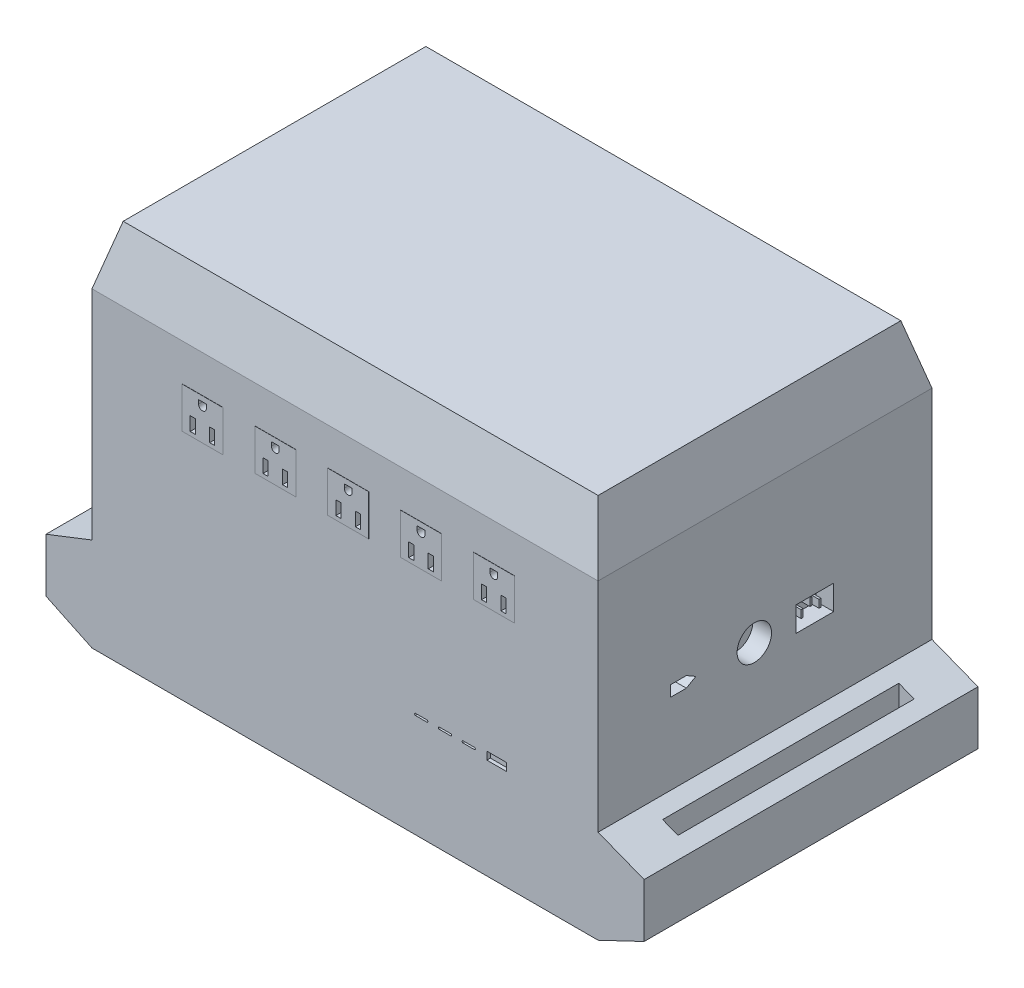
from build123d import *

# Parameters (mm, degrees)
BOSS_EXTRUDE62_DEPTH      = 0.254
BOSS_EXTRUDE63_DEPTH      = 0.254
BOSS_EXTRUDE64_DEPTH      = 0.254
BOSS_EXTRUDE65_DEPTH      = 0.254
BOSS_EXTRUDE66_DEPTH      = 14
BOSS_EXTRUDE66_DEPTH_BACK = 17.62
BOSS_EXTRUDE68_DEPTH      = 168.468
BOSS_EXTRUDE70_DEPTH      = 17.62
BOSS_EXTRUDE71_DEPTH      = 0.254
CHAMFER7_SIZE             = 10.16
CHAMFER7_SIZE2            = 38.1
BOSS_EXTRUDE72_DEPTH      = 0.254
CUT_EXTRUDE49_START       = -0.254
CUT_EXTRUDE49_DEPTH       = 0.254
BOSS_EXTRUDE73_DEPTH      = 0.254
BOSS_EXTRUDE74_DEPTH      = 0.254
BOSS_EXTRUDE75_DEPTH      = 0.254
BOSS_EXTRUDE76_DEPTH      = 0.254
BOSS_EXTRUDE77_DEPTH      = 0.254
SKETCH279_W               = 12.7
SKETCH279_H               = 5.08
CUT_EXTRUDE51_DEPTH       = 12.7
SKETCH280_W               = 10.668
SKETCH280_H               = 3.048
BOSS_EXTRUDE78_DEPTH      = 11.43
CUT_EXTRUDE52_DEPTH       = 12.7
BOSS_EXTRUDE79_DEPTH      = 11.43
CUT_EXTRUDE53_DEPTH       = 12.7
BOSS_EXTRUDE80_DEPTH      = 11.43
CUT_EXTRUDE54_DEPTH       = 12.7
BOSS_EXTRUDE81_DEPTH      = 11.43
CUT_EXTRUDE55_START       = -0.852804
SKETCH301_W               = 24.5364
SKETCH301_H               = 16.129
CUT_EXTRUDE55_DEPTH       = 11.43
SKETCH302_W               = 1.27
SKETCH302_H               = 5.08
BOSS_EXTRUDE82_DEPTH      = 8.89
SKETCH303_W               = 1.27
SKETCH303_H               = 5.08
BOSS_EXTRUDE83_DEPTH      = 8.89
SKETCH304_W               = 1.27
SKETCH304_H               = 5.08
BOSS_EXTRUDE84_DEPTH      = 8.89
CUT_EXTRUDE56_DEPTH       = 12.7
BOSS_EXTRUDE85_DEPTH      = 0.254
SKETCH321_W               = 26.67
SKETCH321_H               = 26.67
BOSS_EXTRUDE86_DEPTH      = 0.127
CUT_EXTRUDE58_DEPTH       = 5.08
SKETCH323_W               = 3.302
SKETCH323_H               = 8.89
CUT_EXTRUDE59_DEPTH       = 5.08
SKETCH332_W               = 3.302
SKETCH332_H               = 8.89
CUT_EXTRUDE60_DEPTH       = 5.08
SKETCH333_W               = 26.67
SKETCH333_H               = 26.67
BOSS_EXTRUDE87_DEPTH      = 0.127
SKETCH334_W               = 3.302
SKETCH334_H               = 8.89
CUT_EXTRUDE61_DEPTH       = 5.08
CUT_EXTRUDE62_DEPTH       = 5.08
SKETCH336_W               = 3.302
SKETCH336_H               = 8.89
CUT_EXTRUDE63_DEPTH       = 5.08
SKETCH337_W               = 26.67
SKETCH337_H               = 26.67
BOSS_EXTRUDE88_DEPTH      = 0.127
SKETCH338_W               = 3.302
SKETCH338_H               = 8.89
CUT_EXTRUDE64_DEPTH       = 5.08
SKETCH339_W               = 3.302
SKETCH339_H               = 8.89
CUT_EXTRUDE65_DEPTH       = 5.08
CUT_EXTRUDE66_DEPTH       = 5.08
SKETCH341_W               = 26.67
SKETCH341_H               = 26.67
BOSS_EXTRUDE89_DEPTH      = 0.127
SKETCH342_W               = 3.302
SKETCH342_H               = 8.89
CUT_EXTRUDE67_DEPTH       = 5.08
CUT_EXTRUDE68_DEPTH       = 5.08
SKETCH344_W               = 3.302
SKETCH344_H               = 8.89
CUT_EXTRUDE69_DEPTH       = 5.08
SKETCH345_W               = 26.67
SKETCH345_H               = 26.67
BOSS_EXTRUDE90_DEPTH      = 0.127
CUT_EXTRUDE70_DEPTH       = 5.08
SKETCH347_W               = 3.302
SKETCH347_H               = 8.89
CUT_EXTRUDE71_DEPTH       = 5.08
SKETCH357_W               = 3.302
SKETCH357_H               = 8.89
CUT_EXTRUDE72_DEPTH       = 5.08
SKETCH358_W               = 11.2395
SKETCH358_H               = 12.192
CUT_EXTRUDE74_DEPTH       = 154
SKETCH360_W               = 10
SKETCH360_H               = 154
CUT_EXTRUDE75_DEPTH       = 333.221604562


with BuildPart() as part:
    # Sketch222 → Boss-Extrude62 (new body)
    with BuildSketch(Plane(origin=(153.035, 0, 0), x_dir=(0, 0, -1), z_dir=(1, 0, 0))):
        Polygon((0.034354968, -137.616206731), (-0.42013952, -134.167377053), (-0.762282621, -134.212281886), (-0.539863782, -135.902665064), (-1.925280449, -136.084956731), (-1.880408654, -136.425000801), (-0.494991987, -136.242709135), (-0.352664263, -137.321034455), (-1.738080929, -137.503326122), (-1.693209135, -137.843370192), align=None)
    extrude(amount=-BOSS_EXTRUDE62_DEPTH)


with BuildPart() as body_2:
    # Sketch227 → Boss-Extrude63 (new body)
    with BuildSketch(Plane(origin=(153.035, 0, 0), x_dir=(0, 0, -1), z_dir=(1, 0, 0))):
        with BuildLine():
            Line((-2.696108223, -138.305593274), (-4.132005659, -136.787664588))
            add(Edge.make_bspline(
                [(-4.678880659, -136.300384941), (-4.662372458, -136.310203099), (-4.626569225, -136.331496866), (-4.572153803, -136.371143308), (-4.512969105, -136.420202524), (-4.446642385, -136.475791675), (-4.376015257, -136.541791218), (-4.299096257, -136.615629275), (-4.217101907, -136.698669745), (-4.161134246, -136.757201507), (-4.132005659, -136.787664588)],
                knots=[0, 0, 0, 0, 0.078414816, 0.170067223, 0.274567044, 0.392385654, 0.523434769, 0.669246216, 0.827857912, 1, 1, 1, 1], degree=3))
            add(Edge.make_bspline(
                [(-4.678880659, -136.300384941), (-5.349031432, -135.906931528), (-5.991380659, -136.538766351)],
                knots=[3.246843398, 3.246843398, 3.246843398, 4.549300373, 4.549300373, 4.549300373], degree=2, weights=[1, 0.795339734, 1]))
            add(Edge.make_bspline(
                [(-5.991380659, -136.538766351), (-6.789321702, -137.384120504), (-5.7964688, -138.361683018)],
                knots=[2.954878484, 2.954878484, 2.954878484, 3.420148464, 3.420148464, 3.420148464], degree=2, weights=[1, 0.973062297, 1]))
            Line((-5.7964688, -138.361683018), (-4.360571364, -139.879611704))
            Line((-4.360571364, -139.879611704), (-4.10886864, -139.641230293))
            Line((-4.10886864, -139.641230293), (-5.544766076, -138.123301608))
            add(Edge.make_bspline(
                [(-5.891821364, -137.70613414), (-5.885456743, -137.71723327), (-5.87141033, -137.741728514), (-5.843814067, -137.779512212), (-5.810644297, -137.823423398), (-5.769994836, -137.872441024), (-5.724261781, -137.928237126), (-5.669768185, -137.987941593), (-5.609630917, -138.053988586), (-5.567025567, -138.099515647), (-5.544766076, -138.123301608)],
                knots=[0, 0, 0, 0, 0.070556672, 0.155715166, 0.257861403, 0.374283895, 0.507046631, 0.655920453, 0.820233007, 1, 1, 1, 1], degree=3))
            add(Edge.make_bspline(
                [(-5.752298127, -136.765228691), (-6.180560511, -137.186653364), (-5.891821364, -137.70613414)],
                knots=[5.71786085, 5.71786085, 5.71786085, 6.800901202, 6.800901202, 6.800901202], degree=2, weights=[1, 0.856926113, 1]))
            add(Edge.make_bspline(
                [(-4.711132262, -136.697920999), (-5.164221722, -136.271568089), (-5.752298127, -136.765228691)],
                knots=[5.997963475, 5.997963475, 5.997963475, 7.159261747, 7.159261747, 7.159261747], degree=2, weights=[1, 0.836106732, 1]))
            ThreePointArc((-4.711132262, -136.697920999), (-4.543178842, -136.857374758), (-4.383007262, -137.024643755))
            Line((-4.383007262, -137.024643755), (-2.947109826, -138.542572441))
            Line((-2.947109826, -138.542572441), (-2.696108223, -138.305593274))
        make_face()
    extrude(amount=-BOSS_EXTRUDE63_DEPTH)


with BuildPart() as body_3:
    # Sketch232 → Boss-Extrude64 (new body)
    with BuildSketch(Plane(origin=(153.035, 0, 0), x_dir=(0, 0, -1), z_dir=(1, 0, 0))):
        with BuildLine():
            Line((-5.999563362, -142.300803327), (-5.847419933, -142.624721596))
            add(Edge.make_bspline(
                [(-5.099322978, -141.845775282), (-5.109063734, -141.885114505), (-5.128433416, -141.96334131), (-5.17532759, -142.074858394), (-5.237222399, -142.178634171), (-5.299641397, -142.259376778), (-5.358663783, -142.319859589), (-5.409161525, -142.365696541), (-5.466807739, -142.409999971), (-5.530151525, -142.454681007), (-5.600571903, -142.497700369), (-5.67686431, -142.54127167), (-5.759681766, -142.584055093), (-5.817634874, -142.610916268), (-5.847419933, -142.624721596)],
                knots=[0, 0, 0, 0, 0.107800502, 0.214363382, 0.320667901, 0.428850354, 0.48518453, 0.545550989, 0.610285758, 0.678654818, 0.751879039, 0.829919405, 0.912586904, 1, 1, 1, 1], degree=3))
            add(Edge.make_bspline(
                [(-5.099322978, -141.845775282), (-4.94215136, -141.017999915), (-5.726125862, -140.848078968)],
                knots=[5.510255877, 5.510255877, 5.510255877, 6.837982393, 6.837982393, 6.837982393], degree=2, weights=[1, 0.787617714, 1]))
            add(Edge.make_bspline(
                [(-6.286322176, -140.918892269), (-6.26308623, -140.908741937), (-6.217222754, -140.888707054), (-6.147157979, -140.864892942), (-6.077030091, -140.847242498), (-6.006973957, -140.83508481), (-5.93656202, -140.829636782), (-5.866260297, -140.829713704), (-5.795789759, -140.834852164), (-5.749432576, -140.843653816), (-5.726125862, -140.848078968)],
                knots=[0, 0, 0, 0, 0.132319091, 0.26117349, 0.385740735, 0.509486853, 0.631872451, 0.753868284, 0.876253882, 1, 1, 1, 1], degree=3))
            add(Edge.make_bspline(
                [(-6.865448779, -141.352185538), (-6.83236233, -141.323555956), (-6.769157487, -141.26886504), (-6.677368396, -141.192625437), (-6.59359611, -141.124909349), (-6.517839596, -141.065837551), (-6.448486313, -141.016881848), (-6.388295664, -140.975311369), (-6.335295177, -140.942890428), (-6.301627049, -140.926392091), (-6.286322176, -140.918892269)],
                knots=[0, 0, 0, 0, 0.181046757, 0.345852518, 0.493713477, 0.626794068, 0.743261104, 0.844918802, 0.929503119, 1, 1, 1, 1], degree=3))
            add(Edge.make_bspline(
                [(-7.536422337, -141.822638263), (-7.30242829, -141.742786071), (-6.865448779, -141.352185538)],
                knots=[0.382022896, 0.382022896, 0.382022896, 1.923493301, 1.923493301, 1.923493301], degree=2, weights=[1, 0.717398675, 1]))
            add(Edge.make_bspline(
                [(-7.898201183, -141.867510057), (-7.869294792, -141.871974114), (-7.810742906, -141.881016368), (-7.720087306, -141.876815441), (-7.627541099, -141.857408107), (-7.567467841, -141.834484861), (-7.536422337, -141.822638263)],
                knots=[0, 0, 0, 0, 0.236659437, 0.479369993, 0.730941497, 1, 1, 1, 1], degree=3))
            add(Edge.make_bspline(
                [(-8.345516888, -141.113804128), (-8.463214925, -141.742146487), (-7.898201183, -141.867510057)],
                knots=[2.17472102, 2.17472102, 2.17472102, 3.554152535, 3.554152535, 3.554152535], degree=2, weights=[1, 0.771426915, 1]))
            add(Edge.make_bspline(
                [(-7.631774901, -140.524160698), (-7.681609506, -140.540182257), (-7.777008312, -140.570852462), (-7.909591401, -140.6276724), (-8.025260253, -140.691125996), (-8.124163748, -140.761442404), (-8.206201786, -140.83900069), (-8.270661542, -140.924036059), (-8.319747787, -141.015419372), (-8.3369492, -141.081093251), (-8.345516888, -141.113804128)],
                knots=[0, 0, 0, 0, 0.161452539, 0.309069959, 0.444318968, 0.567798245, 0.682555306, 0.791156797, 0.895979279, 1, 1, 1, 1], degree=3))
            Line((-7.631774901, -140.524160698), (-7.74465551, -140.19673682))
            add(Edge.make_bspline(
                [(-8.684859837, -141.075943551), (-8.678937999, -141.050363531), (-8.667195929, -140.999642381), (-8.642979468, -140.92624078), (-8.615014355, -140.855230573), (-8.581284231, -140.787706924), (-8.543310135, -140.722677215), (-8.500367466, -140.660832295), (-8.452534012, -140.601804837), (-8.399709539, -140.545438706), (-8.341171411, -140.491628284), (-8.275691262, -140.441407563), (-8.2038933, -140.393425728), (-8.124882967, -140.348821136), (-8.039710443, -140.305900331), (-7.947132059, -140.266981037), (-7.848573799, -140.229575973), (-7.779827534, -140.207851509), (-7.74465551, -140.19673682)],
                knots=[0, 0, 0, 0, 0.057910088, 0.114826584, 0.170369117, 0.226181524, 0.281194839, 0.336413226, 0.392146955, 0.448697817, 0.506734058, 0.567387419, 0.630606369, 0.697129601, 0.767471085, 0.840941519, 0.918622362, 1, 1, 1, 1], degree=3))
            add(Edge.make_bspline(
                [(-8.684859837, -141.075943551), (-8.952427243, -142.080572794), (-7.969014484, -142.238403487)],
                knots=[0.733034147, 0.733034147, 0.733034147, 2.609824335, 2.609824335, 2.609824335], degree=2, weights=[1, 0.59108332, 1]))
            add(Edge.make_bspline(
                [(-6.709098619, -141.695735218), (-6.743285695, -141.725844714), (-6.809496613, -141.784158485), (-6.90848203, -141.865730251), (-7.003688476, -141.938665721), (-7.095027598, -142.003255694), (-7.181741495, -142.060326682), (-7.264496705, -142.108953279), (-7.343386179, -142.149245992), (-7.418766096, -142.181954001), (-7.491882372, -142.207099629), (-7.562860973, -142.228010875), (-7.633033584, -142.242407276), (-7.702286891, -142.252742001), (-7.770547915, -142.256684382), (-7.837765824, -142.255978803), (-7.903992062, -142.250838157), (-7.947338315, -142.242548765), (-7.969014484, -142.238403487)],
                knots=[0, 0, 0, 0, 0.095915869, 0.185762528, 0.270010877, 0.348380461, 0.421263637, 0.48852803, 0.550368245, 0.607680642, 0.661371874, 0.713080446, 0.763362119, 0.812075886, 0.860390352, 0.90714086, 0.953563911, 1, 1, 1, 1], degree=3))
            ThreePointArc((-6.709098619, -141.695735218), (-6.495160019, -141.507397081), (-6.275104228, -141.326244032))
            add(Edge.make_bspline(
                [(-5.786422337, -141.203547718), (-5.8050704, -141.200367125), (-5.842183249, -141.1940372), (-5.89887102, -141.191238244), (-5.955689092, -141.19502588), (-6.013864713, -141.204072046), (-6.074238613, -141.221179728), (-6.137588381, -141.248193916), (-6.206052434, -141.282218135), (-6.251293834, -141.311063051), (-6.275104228, -141.326244032)],
                knots=[0, 0, 0, 0, 0.109431286, 0.217787054, 0.327568948, 0.43854452, 0.55802446, 0.689659623, 0.836668921, 1, 1, 1, 1], degree=3))
            add(Edge.make_bspline(
                [(-5.450584997, -141.764445154), (-5.325881416, -141.285360442), (-5.786422337, -141.203547718)],
                knots=[4.307060765, 4.307060765, 4.307060765, 6.002801772, 6.002801772, 6.002801772], degree=2, weights=[1, 0.661581497, 1]))
            add(Edge.make_bspline(
                [(-5.999563362, -142.300803327), (-5.975894909, -142.28948002), (-5.930160809, -142.267600209), (-5.864986392, -142.233841816), (-5.805041785, -142.201172647), (-5.751598109, -142.168116306), (-5.703173677, -142.137040657), (-5.662148009, -142.104786282), (-5.624983386, -142.075390695), (-5.58536285, -142.034920166), (-5.542382614, -141.983270065), (-5.501659019, -141.915315724), (-5.469996112, -141.842217385), (-5.457116636, -141.790614703), (-5.450584997, -141.764445154)],
                knots=[0, 0, 0, 0, 0.098351719, 0.190043153, 0.27513935, 0.354174642, 0.425614467, 0.49062449, 0.549741308, 0.603019033, 0.702634755, 0.800900588, 0.899029628, 1, 1, 1, 1], degree=3))
        make_face()
    extrude(amount=-BOSS_EXTRUDE64_DEPTH)


with BuildPart() as body_4:
    # Sketch237 → Boss-Extrude65 (new body)
    with BuildSketch(Plane(origin=(153.035, 0, 0), x_dir=(0, 0, -1), z_dir=(1, 0, 0))):
        Polygon((-5.273509799, -144.160084418), (-8.49656669, -145.436126085), (-7.77020451, -147.269559579), (-7.452596337, -147.144058777), (-8.05135435, -145.632440188), (-6.787231754, -145.131839226), (-6.188473741, -146.643457816), (-5.872968933, -146.517957014), (-6.471726946, -145.006338425), (-5.463513805, -144.607400123), (-4.85984794, -146.132340027), (-4.542239767, -146.006839226), align=None)
    extrude(amount=-BOSS_EXTRUDE65_DEPTH)


with BuildPart() as body_5:
    # Sketch242 → Boss-Extrude66 (new, two sides: drawn at the far end of the back side and taken through both)
    with BuildSketch(Plane(origin=(0, 0, -101.854), x_dir=(-1, 0, 0), z_dir=(0, 0, -1)).offset(-BOSS_EXTRUDE66_DEPTH_BACK)):
        Polygon((167.149803952, -19.122662796), (-162.850196048, -19.122662796), (-162.850196048, -199.122662796), (-192.850196048, -210.839421848), (-192.850196048, -245.839421848), (-162.850196048, -260.122662796), (167.149803952, -260.122662796), (197.149803952, -245.839421848), (197.149803952, -210.839421848), (167.149803952, -199.122662796), align=None)
    extrude(amount=BOSS_EXTRUDE66_DEPTH + BOSS_EXTRUDE66_DEPTH_BACK)

    # Sketch244 → Boss-Extrude68 (add)
    with BuildSketch(Plane.XY.offset(-84.234)):
        Polygon((-167.149803952, -260.122662796), (-197.149803952, -245.839421848), (-197.149803952, -210.839421848), (-167.149803952, -199.122662796), (-167.149803952, -19.122662796), (162.850196048, -19.122662796), (162.850196048, -199.122662796), (192.850196048, -210.839421848), (192.850196048, -245.839421848), (162.850196048, -260.122662796), align=None)
    extrude(amount=BOSS_EXTRUDE68_DEPTH)

    # Sketch246 → Boss-Extrude70 (add)
    with BuildSketch(Plane.XY.offset(84.234)):
        Polygon((162.850196048, -199.122662796), (192.850196048, -210.839421848), (192.850196048, -245.839421848), (162.850196048, -260.122662796), (-167.149803952, -260.122662796), (-197.149803952, -245.839421848), (-197.149803952, -210.839421848), (-167.149803952, -199.122662796), (-167.149803952, -19.122662796), (162.850196048, -19.122662796), align=None)
    extrude(amount=BOSS_EXTRUDE70_DEPTH)

    # Sketch252 → Boss-Extrude71 (add)
    with BuildSketch(Plane.ZY.offset(163.703)):
        with BuildLine():
            Line((-11.778846154, -143.2), (-12.479266827, -143.2))
            ThreePointArc((-12.479266827, -143.2), (-12.876761888, -143.192971947), (-13.272235577, -143.152323718))
            add(Edge.make_bspline(
                [(-13.977564103, -142.264002404), (-13.997889265, -142.991240506), (-13.272235577, -143.152323718)],
                knots=[2.612710294, 2.612710294, 2.612710294, 3.903655022, 3.903655022, 3.903655022], degree=2, weights=[1, 0.798815693, 1]))
            Line((-13.977564103, -142.264002404), (-14.022435897, -143.688549892))
            Line((-14.022435897, -143.688549892), (-14.022435897, -139.7))
            Line((-14.022435897, -139.7), (-13.634014423, -139.7))
            Line((-13.634014423, -139.7), (-13.634014423, -141.315384615))
            Line((-13.634014423, -141.315384615), (-12.092948718, -141.315384615))
            Line((-12.092948718, -141.315384615), (-12.092948718, -139.7))
            Line((-12.092948718, -139.7), (-11.778846154, -139.7))
            Line((-11.778846154, -139.7), (-11.778846154, -143.2))
        make_face()
    extrude(amount=BOSS_EXTRUDE71_DEPTH)

    # Chamfer7
    chamfer7_edges = [body_5.edges().sort_by_distance(p)[0] for p in [
        (162.850196048, -19.122662796, -7),
        (-167.149803952, -19.122662796, -7),
        (-2.149803952, -19.122662796, 101.854),
        (-2.149803952, -19.122662796, -115.854),
    ]]
    chamfer7_side = [body_5.faces().sort_by_distance(p)[0] for p in [
        (-2.149803952, -19.122662796, -7),
    ]]
    chamfer(chamfer7_edges, length=CHAMFER7_SIZE, length2=CHAMFER7_SIZE2, reference=chamfer7_side[0])

    # Sketch253 → Boss-Extrude72 (add)
    with BuildSketch(Plane.ZY.offset(167.149803952)):
        with BuildLine():
            add(Edge.make_bspline(
                [(-1.929487179, -143.28974359), (-0.124286675, -143.279325183), (-0.112179487, -141.434575321)],
                knots=[2.54181032, 2.54181032, 2.54181032, 4.026500397, 4.026500397, 4.026500397], degree=2, weights=[1, 0.736885299, 1]))
            add(Edge.make_bspline(
                [(-0.112179487, -141.434575321), (-0.007788697, -139.493930813), (-1.957532051, -139.61025641)],
                knots=[0.623390148, 0.623390148, 0.623390148, 2.491593261, 2.491593261, 2.491593261], degree=2, weights=[1, 0.594541073, 1]))
            add(Edge.make_bspline(
                [(-1.957532051, -139.61025641), (-3.893543925, -139.507231889), (-3.791666667, -141.451402244)],
                knots=[0.635551913, 0.635551913, 0.635551913, 2.482047765, 2.482047765, 2.482047765], degree=2, weights=[1, 0.603232911, 1]))
            add(Edge.make_bspline(
                [(-3.791666667, -141.451402244), (-3.870755775, -143.37554185), (-1.929487179, -143.28974359)],
                knots=[3.789872842, 3.789872842, 3.789872842, 5.545633515, 5.545633515, 5.545633515], degree=2, weights=[1, 0.638783419, 1]))
        make_face()
    extrude(amount=BOSS_EXTRUDE72_DEPTH)

    # Sketch254 → Cut-Extrude49 (cut)
    with BuildSketch(Plane.ZY.offset(167.403803952).offset(CUT_EXTRUDE49_START)):
        with BuildLine():
            add(Edge.make_bspline(
                [(-1.944911859, -139.969230769), (-3.473521434, -139.994036287), (-3.477564103, -141.452103365)],
                knots=[5.449528241, 5.449528241, 5.449528241, 6.837835776, 6.837835776, 6.837835776], degree=2, weights=[1, 0.768595341, 1]))
            add(Edge.make_bspline(
                [(-3.477564103, -141.452103365), (-3.499988268, -142.9026144), (-1.944911859, -142.930769231)],
                knots=[5.967408591, 5.967408591, 5.967408591, 7.478038568, 7.478038568, 7.478038568], degree=2, weights=[1, 0.728055649, 1]))
            add(Edge.make_bspline(
                [(-1.944911859, -142.930769231), (-0.41354277, -142.901601423), (-0.426282051, -141.435977564)],
                knots=[5.242310528, 5.242310528, 5.242310528, 6.736784146, 6.736784146, 6.736784146], degree=2, weights=[1, 0.733569571, 1]))
            add(Edge.make_bspline(
                [(-0.426282051, -141.435977564), (-0.329189577, -139.89041296), (-1.944911859, -139.969230769)],
                knots=[3.665395708, 3.665395708, 3.665395708, 5.531042126, 5.531042126, 5.531042126], degree=2, weights=[1, 0.595568462, 1]))
        make_face()
    extrude(amount=-CUT_EXTRUDE49_DEPTH, mode=Mode.SUBTRACT)

    # Sketch256 → Boss-Extrude73 (add)
    with BuildSketch(Plane.ZY.offset(167.149803952)):
        with BuildLine():
            Line((11.240384615, -142.123076923), (11.554487179, -142.123076923))
            add(Edge.make_bspline(
                [(10.413060897, -143.28974359), (11.572883316, -143.336041335), (11.554487179, -142.123076923)],
                knots=[3.559984364, 3.559984364, 3.559984364, 5.247750415, 5.247750415, 5.247750415], degree=2, weights=[1, 0.664566333, 1]))
            add(Edge.make_bspline(
                [(9.355769231, -142.249278846), (9.332286609, -143.357231486), (10.413060897, -143.28974359)],
                knots=[0.828508128, 0.828508128, 0.828508128, 2.570188795, 2.570188795, 2.570188795], degree=2, weights=[1, 0.644184028, 1]))
            add(Edge.make_bspline(
                [(9.355769231, -142.249278846), (9.357465391, -142.200532151), (9.360827947, -142.103894195), (9.389499853, -141.961862635), (9.434476408, -141.824429306), (9.487979842, -141.713391462), (9.541750568, -141.62382282), (9.59147646, -141.550765068), (9.648906646, -141.471671664), (9.714886908, -141.386627694), (9.790413872, -141.296718808), (9.872606431, -141.199529487), (9.965091208, -141.098131532), (10.029714797, -141.028796346), (10.063201122, -140.99286859)],
                knots=[0, 0, 0, 0, 0.098684951, 0.195638122, 0.292371336, 0.391068783, 0.444585255, 0.503947734, 0.570059743, 0.642613903, 0.721976686, 0.807954682, 0.900486928, 1, 1, 1, 1], degree=3))
            Line((10.063201122, -140.99286859), (10.938902244, -140.058974359))
            Line((10.938902244, -140.058974359), (9.310897436, -140.058974359))
            Line((9.310897436, -140.058974359), (9.310897436, -139.7))
            Line((9.310897436, -139.7), (11.689102564, -139.7))
            Line((11.689102564, -139.7), (11.689102564, -139.73175051))
            add(Edge.make_bspline(
                [(11.689102564, -139.73175051), (11.236645299, -140.204006216), (10.751137808, -140.710758347), (10.235197821, -141.249274626), (10.145446028, -141.346042341), (10.064704818, -141.435709677), (9.992920634, -141.518673971), (9.93003441, -141.594464892), (9.876247354, -141.663676397), (9.831321739, -141.725714532), (9.783709949, -141.798594339), (9.738308947, -141.887681869), (9.698406112, -141.996003864), (9.674249479, -142.107759457), (9.671336865, -142.183257707), (9.669871795, -142.221233974)],
                knots=[-1.516771106, -1.516771106, -1.516771106, -1.516771106, 0, 0.110794173, 0.212812933, 0.30607791, 0.390617458, 0.467232727, 0.534450618, 0.593866801, 0.644832969, 0.736220619, 0.825037402, 0.911992313, 1, 1, 1, 1], degree=3))
            add(Edge.make_bspline(
                [(9.669871795, -142.221233974), (9.630186637, -142.976356496), (10.429186699, -142.930769231)],
                knots=[0.495399928, 0.495399928, 0.495399928, 2.372577772, 2.372577772, 2.372577772], degree=2, weights=[1, 0.590926965, 1]))
            add(Edge.make_bspline(
                [(10.429186699, -142.930769231), (11.194747675, -142.94016904), (11.240384615, -142.123076923)],
                knots=[2.629699464, 2.629699464, 2.629699464, 3.910289785, 3.910289785, 3.910289785], degree=2, weights=[1, 0.801919454, 1]))
        make_face()
    extrude(amount=BOSS_EXTRUDE73_DEPTH)

    # Sketch257 → Boss-Extrude74 (add)
    with BuildSketch(Plane.ZY.offset(167.149803952)):
        Polygon((-4.28525641, -143.2), (-4.609174679, -143.2), (-5.294871795, -140.631089744), (-6.335797571, -143.257778478), (-7.358974359, -140.650721154), (-8.047475962, -143.2), (-8.368589744, -143.2), (-8.368589744, -139.7), (-7.380008013, -139.7), (-6.326923077, -142.375480769), (-5.262620192, -139.7), (-4.28525641, -139.7), align=None)
    extrude(amount=BOSS_EXTRUDE74_DEPTH)

    # Sketch258 → Boss-Extrude75 (add)
    with BuildSketch(Plane.ZY.offset(167.149803952)):
        Polygon((-9.176282051, -143.2), (-11.150641026, -143.2), (-11.150641026, -142.841025641), (-9.490384615, -142.841025641), (-9.490384615, -141.764102564), (-11.150641026, -141.764102564), (-11.150641026, -141.405128205), (-9.490384615, -141.405128205), (-9.490384615, -140.058974359), (-11.150641026, -140.058974359), (-11.150641026, -139.7), (-9.176282051, -139.7), align=None)
    extrude(amount=BOSS_EXTRUDE75_DEPTH)

    # Sketch265 → Boss-Extrude76 (add)
    with BuildSketch(Plane.ZY.offset(163.703)):
        Polygon((13.637520032, -143.2), (12.990384615, -143.2), (12.990384615, -139.7), (13.304487179, -139.7), (13.304487179, -142.841025641), (13.637520032, -142.841025641), align=None)
    extrude(amount=BOSS_EXTRUDE76_DEPTH)

    # Sketch272 → Boss-Extrude77 (add)
    with BuildSketch(Plane.ZY.offset(163.703)):
        Polygon((7.605769231, -143.2), (7.269230769, -143.2), (6.103265224, -140.443890224), (4.936598558, -143.2), (4.599358974, -143.2), (4.599358974, -136.093939394), align=None)
    extrude(amount=BOSS_EXTRUDE77_DEPTH)

    # Sketch279 → Cut-Extrude51 (cut)
    with BuildSketch(Plane.XY.offset(101.854)):
        with Locations((96.647, -192.151)):
            Rectangle(SKETCH279_W, SKETCH279_H)
    extrude(amount=-CUT_EXTRUDE51_DEPTH, mode=Mode.SUBTRACT)

    # Sketch280 → Boss-Extrude78 (add)
    with BuildSketch(Plane.XY.offset(89.154)):
        with Locations((96.647, -192.151)):
            Rectangle(SKETCH280_W, SKETCH280_H)
    extrude(amount=BOSS_EXTRUDE78_DEPTH)

    # Sketch281 → Cut-Extrude52 (cut)
    with BuildSketch(Plane.XY.offset(101.854)):
        with BuildLine():
            Line((82.169, -191.516), (74.803, -191.516))
            ThreePointArc((74.803, -191.516), (74.168, -192.151), (74.803, -192.786))
            Line((74.803, -192.786), (82.169, -192.786))
            ThreePointArc((82.169, -192.786), (82.804, -192.151), (82.169, -191.516))
        make_face()
    extrude(amount=-CUT_EXTRUDE52_DEPTH, mode=Mode.SUBTRACT)

    # Sketch282 → Boss-Extrude79 (add)
    with BuildSketch(Plane.XY.offset(89.154)):
        with BuildLine():
            Line((74.803, -192.024), (82.169, -192.024))
            ThreePointArc((82.169, -192.024), (82.296, -192.151), (82.169, -192.278))
            Line((82.169, -192.278), (74.803, -192.278))
            ThreePointArc((74.803, -192.278), (74.676, -192.151), (74.803, -192.024))
        make_face()
    extrude(amount=BOSS_EXTRUDE79_DEPTH)

    # Sketch290 → Cut-Extrude53 (cut)
    with BuildSketch(Plane.XY.offset(101.854)):
        with BuildLine():
            Line((59.309, -192.786), (66.675, -192.786))
            ThreePointArc((66.675, -192.786), (67.31, -192.151), (66.675, -191.516))
            Line((66.675, -191.516), (59.309, -191.516))
            ThreePointArc((59.309, -191.516), (58.674, -192.151), (59.309, -192.786))
        make_face()
    extrude(amount=-CUT_EXTRUDE53_DEPTH, mode=Mode.SUBTRACT)

    # Sketch291 → Boss-Extrude80 (add)
    with BuildSketch(Plane.XY.offset(89.154)):
        with BuildLine():
            Line((66.675, -192.278), (59.309, -192.278))
            ThreePointArc((59.309, -192.278), (59.182, -192.151), (59.309, -192.024))
            Line((59.309, -192.024), (66.675, -192.024))
            ThreePointArc((66.675, -192.024), (66.802, -192.151), (66.675, -192.278))
        make_face()
    extrude(amount=BOSS_EXTRUDE80_DEPTH)

    # Sketch292 → Cut-Extrude54 (cut)
    with BuildSketch(Plane.XY.offset(101.854)):
        with BuildLine():
            Line((43.815, -192.786), (51.181, -192.786))
            ThreePointArc((51.181, -192.786), (51.816, -192.151), (51.181, -191.516))
            Line((51.181, -191.516), (43.815, -191.516))
            ThreePointArc((43.815, -191.516), (43.18, -192.151), (43.815, -192.786))
        make_face()
    extrude(amount=-CUT_EXTRUDE54_DEPTH, mode=Mode.SUBTRACT)

    # Sketch293 → Boss-Extrude81 (add)
    with BuildSketch(Plane.XY.offset(89.154)):
        with BuildLine():
            Line((51.181, -192.278), (43.815, -192.278))
            ThreePointArc((43.815, -192.278), (43.688, -192.151), (43.815, -192.024))
            Line((43.815, -192.024), (51.181, -192.024))
            ThreePointArc((51.181, -192.024), (51.308, -192.151), (51.181, -192.278))
        make_face()
    extrude(amount=BOSS_EXTRUDE81_DEPTH)

    # Sketch301 → Cut-Extrude55 (cut)
    with BuildSketch(Plane(origin=(163.703, 0, 0), x_dir=(0, 0, -1), z_dir=(1, 0, 0)).offset(CUT_EXTRUDE55_START)):
        with Locations((39.497, -143.3195)):
            Rectangle(SKETCH301_W, SKETCH301_H)
    extrude(amount=-CUT_EXTRUDE55_DEPTH, mode=Mode.SUBTRACT)

    # Sketch302 → Boss-Extrude82 (add)
    with BuildSketch(Plane(origin=(151.420196048, 0, 0), x_dir=(0, 0, -1), z_dir=(1, 0, 0))):
        with Locations((39.497, -140.796713638)):
            Rectangle(SKETCH302_W, SKETCH302_H)
    extrude(amount=BOSS_EXTRUDE82_DEPTH)

    # Sketch303 → Boss-Extrude83 (add)
    with BuildSketch(Plane(origin=(151.420196048, 0, 0), x_dir=(0, 0, -1), z_dir=(1, 0, 0))):
        with Locations((33.666112591, -144.689593499)):
            Rectangle(SKETCH303_W, SKETCH303_H)
    extrude(amount=BOSS_EXTRUDE83_DEPTH)

    # Sketch304 → Boss-Extrude84 (add)
    with BuildSketch(Plane(origin=(151.420196048, 0, 0), x_dir=(0, 0, -1), z_dir=(1, 0, 0))):
        with Locations((45.327887409, -144.689593499)):
            Rectangle(SKETCH304_W, SKETCH304_H)
    extrude(amount=BOSS_EXTRUDE84_DEPTH)

    # Sketch305 → Cut-Extrude56 (cut)
    with BuildSketch(Plane(origin=(162.850196048, 0, 0), x_dir=(0, 0, -1), z_dir=(1, 0, 0))):
        Polygon((-44.298514672, -146.558), (-38.139342, -143.002), (-44.298514672, -139.446), (-54.61, -139.446), (-54.61, -146.558), align=None)
    extrude(amount=-CUT_EXTRUDE56_DEPTH, mode=Mode.SUBTRACT)

    # Sketch312 → Boss-Extrude85 (add)
    with BuildSketch(Plane.ZY.offset(163.703)):
        with BuildLine():
            Line((2.580128205, -143.2), (1.893729968, -143.2))
            add(Edge.make_bspline(
                [(1.096554487, -143.147415865), (1.237634886, -143.201107466), (1.893729968, -143.2)],
                knots=[3.358265591, 3.358265591, 3.358265591, 4.730618437, 4.730618437, 4.730618437], degree=2, weights=[1, 0.77367422, 1]))
            add(Edge.make_bspline(
                [(0.426282051, -142.261197917), (0.414579803, -142.963279647), (1.096554487, -143.147415865)],
                knots=[2.646819026, 2.646819026, 2.646819026, 3.653824505, 3.653824505, 3.653824505], degree=2, weights=[1, 0.875897879, 1]))
            add(Edge.make_bspline(
                [(1.124599359, -141.372876603), (0.41507097, -141.539311716), (0.426282051, -142.261197917)],
                knots=[2.62988266, 2.62988266, 2.62988266, 3.629193888, 3.629193888, 3.629193888], degree=2, weights=[1, 0.877747617, 1]))
            add(Edge.make_bspline(
                [(2.015725162, -141.315384616), (1.139997078, -141.305070616), (1.124599359, -141.372876603)],
                knots=[0.927972219, 0.927972219, 0.927972219, 3.125387461, 3.125387461, 3.125387461], degree=2, weights=[1, 0.45474752, 1]))
            Line((2.015725162, -141.315384616), (2.266025642, -141.315384616))
            Line((2.266025642, -141.315384616), (2.266025642, -139.7))
            Line((2.266025642, -139.7), (2.580128205, -139.7))
            Line((2.580128205, -139.7), (2.580128205, -143.2))
        make_face()
    extrude(amount=BOSS_EXTRUDE85_DEPTH)

    # Sketch321 → Boss-Extrude86 (add)
    with BuildSketch(Plane.XY.offset(101.854)):
        with Locations((0, -94.869)):
            Rectangle(SKETCH321_W, SKETCH321_H)
    extrude(amount=BOSS_EXTRUDE86_DEPTH)

    # Sketch322 → Cut-Extrude58 (cut)
    with BuildSketch(Plane.XY.offset(101.981)):
        with BuildLine():
            Line((2.54, -84.963), (-2.54, -84.963))
            Line((-2.54, -84.963), (-2.54, -87.503))
            ThreePointArc((-2.54, -87.503), (0, -90.043), (2.54, -87.503))
            Line((2.54, -87.503), (2.54, -84.963))
        make_face()
    extrude(amount=-CUT_EXTRUDE58_DEPTH, mode=Mode.SUBTRACT)

    # Sketch323 → Cut-Extrude59 (cut)
    with BuildSketch(Plane.XY.offset(101.981)):
        with Locations((-6.35, -101.219)):
            Rectangle(SKETCH323_W, SKETCH323_H)
    extrude(amount=-CUT_EXTRUDE59_DEPTH, mode=Mode.SUBTRACT)

    # Sketch332 → Cut-Extrude60 (cut)
    with BuildSketch(Plane.XY.offset(101.981)):
        with Locations((6.35, -101.219)):
            Rectangle(SKETCH332_W, SKETCH332_H)
    extrude(amount=-CUT_EXTRUDE60_DEPTH, mode=Mode.SUBTRACT)

    # Sketch333 → Boss-Extrude87 (add)
    with BuildSketch(Plane.XY.offset(101.854)):
        with Locations((-47.498, -94.869)):
            Rectangle(SKETCH333_W, SKETCH333_H)
    extrude(amount=BOSS_EXTRUDE87_DEPTH)

    # Sketch334 → Cut-Extrude61 (cut)
    with BuildSketch(Plane.XY.offset(101.981)):
        with Locations((-53.848, -101.219)):
            Rectangle(SKETCH334_W, SKETCH334_H)
    extrude(amount=-CUT_EXTRUDE61_DEPTH, mode=Mode.SUBTRACT)

    # Sketch335 → Cut-Extrude62 (cut)
    with BuildSketch(Plane.XY.offset(101.981)):
        with BuildLine():
            Line((-44.958, -84.963), (-50.038, -84.963))
            Line((-50.038, -84.963), (-50.038, -87.503))
            ThreePointArc((-50.038, -87.503), (-47.498, -90.043), (-44.958, -87.503))
            Line((-44.958, -87.503), (-44.958, -84.963))
        make_face()
    extrude(amount=-CUT_EXTRUDE62_DEPTH, mode=Mode.SUBTRACT)

    # Sketch336 → Cut-Extrude63 (cut)
    with BuildSketch(Plane.XY.offset(101.981)):
        with Locations((-41.148, -101.219)):
            Rectangle(SKETCH336_W, SKETCH336_H)
    extrude(amount=-CUT_EXTRUDE63_DEPTH, mode=Mode.SUBTRACT)

    # Sketch337 → Boss-Extrude88 (add)
    with BuildSketch(Plane.XY.offset(101.854)):
        with Locations((-94.996, -94.869)):
            Rectangle(SKETCH337_W, SKETCH337_H)
    extrude(amount=BOSS_EXTRUDE88_DEPTH)

    # Sketch338 → Cut-Extrude64 (cut)
    with BuildSketch(Plane.XY.offset(101.981)):
        with Locations((-88.646, -101.219)):
            Rectangle(SKETCH338_W, SKETCH338_H)
    extrude(amount=-CUT_EXTRUDE64_DEPTH, mode=Mode.SUBTRACT)

    # Sketch339 → Cut-Extrude65 (cut)
    with BuildSketch(Plane.XY.offset(101.981)):
        with Locations((-101.346, -101.219)):
            Rectangle(SKETCH339_W, SKETCH339_H)
    extrude(amount=-CUT_EXTRUDE65_DEPTH, mode=Mode.SUBTRACT)

    # Sketch340 → Cut-Extrude66 (cut)
    with BuildSketch(Plane.XY.offset(101.981)):
        with BuildLine():
            Line((-92.456, -84.963), (-97.536, -84.963))
            Line((-97.536, -84.963), (-97.536, -87.503))
            ThreePointArc((-97.536, -87.503), (-94.996, -90.043), (-92.456, -87.503))
            Line((-92.456, -87.503), (-92.456, -84.963))
        make_face()
    extrude(amount=-CUT_EXTRUDE66_DEPTH, mode=Mode.SUBTRACT)

    # Sketch341 → Boss-Extrude89 (add)
    with BuildSketch(Plane.XY.offset(101.854)):
        with Locations((47.498, -94.869)):
            Rectangle(SKETCH341_W, SKETCH341_H)
    extrude(amount=BOSS_EXTRUDE89_DEPTH)

    # Sketch342 → Cut-Extrude67 (cut)
    with BuildSketch(Plane.XY.offset(101.981)):
        with Locations((53.848, -101.219)):
            Rectangle(SKETCH342_W, SKETCH342_H)
    extrude(amount=-CUT_EXTRUDE67_DEPTH, mode=Mode.SUBTRACT)

    # Sketch343 → Cut-Extrude68 (cut)
    with BuildSketch(Plane.XY.offset(101.981)):
        with BuildLine():
            Line((50.038, -84.963), (44.958, -84.963))
            Line((44.958, -84.963), (44.958, -87.503))
            ThreePointArc((44.958, -87.503), (47.498, -90.043), (50.038, -87.503))
            Line((50.038, -87.503), (50.038, -84.963))
        make_face()
    extrude(amount=-CUT_EXTRUDE68_DEPTH, mode=Mode.SUBTRACT)

    # Sketch344 → Cut-Extrude69 (cut)
    with BuildSketch(Plane.XY.offset(101.981)):
        with Locations((41.148, -101.219)):
            Rectangle(SKETCH344_W, SKETCH344_H)
    extrude(amount=-CUT_EXTRUDE69_DEPTH, mode=Mode.SUBTRACT)

    # Sketch345 → Boss-Extrude90 (add)
    with BuildSketch(Plane.XY.offset(101.854)):
        with Locations((94.996, -94.869)):
            Rectangle(SKETCH345_W, SKETCH345_H)
    extrude(amount=BOSS_EXTRUDE90_DEPTH)

    # Sketch346 → Cut-Extrude70 (cut)
    with BuildSketch(Plane.XY.offset(101.981)):
        with BuildLine():
            Line((97.536, -84.963), (92.456, -84.963))
            Line((92.456, -84.963), (92.456, -87.503))
            ThreePointArc((92.456, -87.503), (94.996, -90.043), (97.536, -87.503))
            Line((97.536, -87.503), (97.536, -84.963))
        make_face()
    extrude(amount=-CUT_EXTRUDE70_DEPTH, mode=Mode.SUBTRACT)

    # Sketch347 → Cut-Extrude71 (cut)
    with BuildSketch(Plane.XY.offset(101.981)):
        with Locations((88.646, -101.219)):
            Rectangle(SKETCH347_W, SKETCH347_H)
    extrude(amount=-CUT_EXTRUDE71_DEPTH, mode=Mode.SUBTRACT)

    # Sketch357 → Cut-Extrude72 (cut)
    with BuildSketch(Plane.XY.offset(101.981)):
        with Locations((101.346, -101.219)):
            Rectangle(SKETCH357_W, SKETCH357_H)
    extrude(amount=-CUT_EXTRUDE72_DEPTH, mode=Mode.SUBTRACT)

    # Sketch358 → M20 Clearance Hole3 (revolve, cut)
    with BuildSketch(Plane(origin=(162.850196048, -143.002, 0), x_dir=(0, 0, -1), z_dir=(0, 1, 0))):
        with Locations((5.61975, 6.096)):
            Rectangle(SKETCH358_W, SKETCH358_H)
    revolve(axis=Axis((169.200196048, -143.002, 0), (-1, 0, 0)), mode=Mode.SUBTRACT)

    # Sketch243 → Cut-Extrude74 (cut)
    with BuildSketch(Plane.XY.offset(-84.234)):
        Polygon((182.850196048, -250.600502164), (172.850196048, -255.36158248), (172.850196048, -203.028249147), (182.850196048, -206.933835498), align=None)
    extrude(amount=CUT_EXTRUDE74_DEPTH, mode=Mode.SUBTRACT)

    # Sketch360 → Cut-Extrude75 (cut, through all)
    with BuildSketch(Plane(origin=(0, -19.122662796, 0), x_dir=(1, 0, 0), z_dir=(0, 1, 0))):
        with Locations((-182.149803952, 7.234)):
            Rectangle(SKETCH360_W, SKETCH360_H)
    extrude(amount=-CUT_EXTRUDE75_DEPTH, mode=Mode.SUBTRACT)


solid = Compound([part.part, body_2.part, body_3.part, body_4.part, body_5.part])
